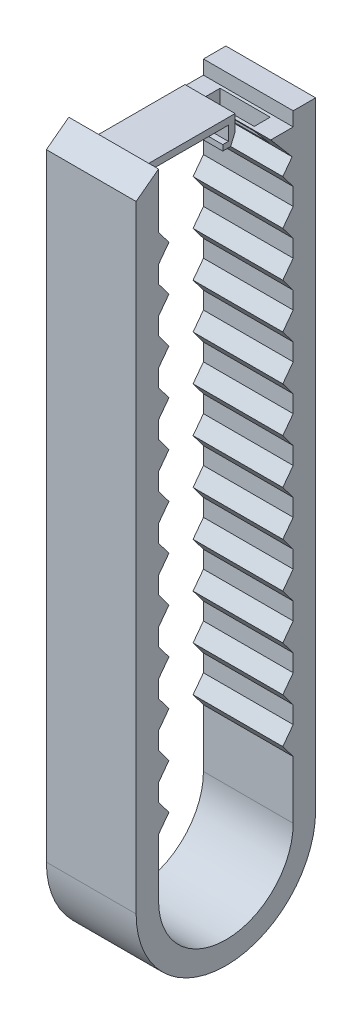
from build123d import *

# Parameters (mm, degrees)
BOSS_EXTRUDE1_DEPTH = 8
BOSS_EXTRUDE2_DEPTH = 8
BOSS_EXTRUDE4_DEPTH = 8
SKETCH10_W          = 4.468992015
SKETCH10_H          = 1.428902643
CUT_EXTRUDE2_DEPTH  = 2
SKETCH11_W          = 1.778541799
SKETCH11_H          = 8.6
SKETCH11_W_2        = 1.752466186
CUT_EXTRUDE4_DEPTH  = 2.5
CUT_EXTRUDE6_DEPTH  = 14.47


with BuildPart() as part:
    # Sketch2 → Boss-Extrude1 (new body)
    with BuildSketch(Plane.YZ):
        with BuildLine():
            Line((55, 6), (0, 6))
            ThreePointArc((0, 6), (-6, 0), (0, -6))
            Line((0, -6), (55, -6))
            Line((55, -6), (55, -8))
            Line((55, -8), (0, -8))
            ThreePointArc((0, -8), (-8, 0), (0, 8))
            Line((0, 8), (55, 8))
            Line((55, 8), (55, 6))
        make_face()
    extrude(amount=BOSS_EXTRUDE1_DEPTH)

    # Sketch8 → Boss-Extrude2 (add)
    with BuildSketch(Plane.YZ):
        Polygon((8.883709987, 6.2), (11.885253021, 6.2), (10.384481504, 5.074983791), align=None)
        Polygon((4.883709987, 6.2), (7.885253021, 6.2), (6.384481504, 5.074983791), align=None)
        Polygon((12.883709987, 6.2), (15.885253021, 6.2), (14.384481504, 5.074983791), align=None)
        Polygon((16.883709987, 6.2), (19.885253021, 6.2), (18.384481504, 5.074983791), align=None)
        Polygon((20.883709987, 6.2), (23.885253021, 6.2), (22.384481504, 5.074983791), align=None)
        Polygon((24.883709987, 6.2), (27.885253021, 6.2), (26.384481504, 5.074983791), align=None)
        Polygon((28.883709987, 6.2), (31.885253021, 6.2), (30.384481504, 5.074983791), align=None)
        Polygon((32.883709987, 6.2), (35.885253021, 6.2), (34.384481504, 5.074983791), align=None)
        Polygon((36.883709987, 6.2), (39.885253021, 6.2), (38.384481504, 5.074983791), align=None)
        Polygon((40.883709987, 6.2), (43.885253021, 6.2), (42.384481504, 5.074983791), align=None)
        Polygon((44.883709987, 6.2), (47.885253021, 6.2), (46.384481504, 5.074983791), align=None)
        Polygon((48.883709987, 6.2), (51.885253021, 6.2), (50.384481504, 5.074983791), align=None)
    boss_extrude2 = extrude(amount=BOSS_EXTRUDE2_DEPTH)

    # Mirror1: Boss-Extrude2 across plane
    add(boss_extrude2.mirror(Plane.XY))

    # Sketch9 → Boss-Extrude4 (add)
    with BuildSketch(Plane.YZ):
        Polygon((55, 6), (55, -2), (53.75, -2), (53.75, -1.5), (53.25, -1.5), (53.25, -2), (53.25, -2.6), (55.6, -2.6), (55.6, 6), (56.503482489, 6), (55, 8), align=None)
        Polygon((53.75, -4.000391414), (51.384098648, -6), (53.75, -6), align=None)
    extrude(amount=BOSS_EXTRUDE4_DEPTH)

    # Sketch10 → Cut-Extrude2 (cut)
    with BuildSketch(Plane(origin=(0, 53.75, 0), x_dir=(-1, 0, 0), z_dir=(0, 1, 0))):
        with Locations((-3.986962194, -5.0167747)):
            Rectangle(SKETCH10_W, SKETCH10_H)
    extrude(amount=-CUT_EXTRUDE2_DEPTH, mode=Mode.SUBTRACT)

    # Sketch11 → Cut-Extrude4 (cut)
    with BuildSketch(Plane(origin=(0, 55.6, 0), x_dir=(-1, 0, 0), z_dir=(0, 1, 0))):
        with Locations((-7.110729101, 1.7)):
            Rectangle(SKETCH11_W, SKETCH11_H)
        with Locations((-0.876233093, 1.7)):
            Rectangle(SKETCH11_W_2, SKETCH11_H)
    extrude(amount=-CUT_EXTRUDE4_DEPTH, mode=Mode.SUBTRACT)

    # Sketch12 → Cut-Extrude6 (cut)
    with BuildSketch(Plane(origin=(1.752466186, 0, 0), x_dir=(0, -1, 0), z_dir=(-1, 0, 0))):
        Polygon((-53.25, -2.6), (-53.25, -2.199701503), (-54.173023817, -2.6), (-53.75, -2.6), align=None)
    extrude(amount=-CUT_EXTRUDE6_DEPTH, mode=Mode.SUBTRACT)


solid = part.part
